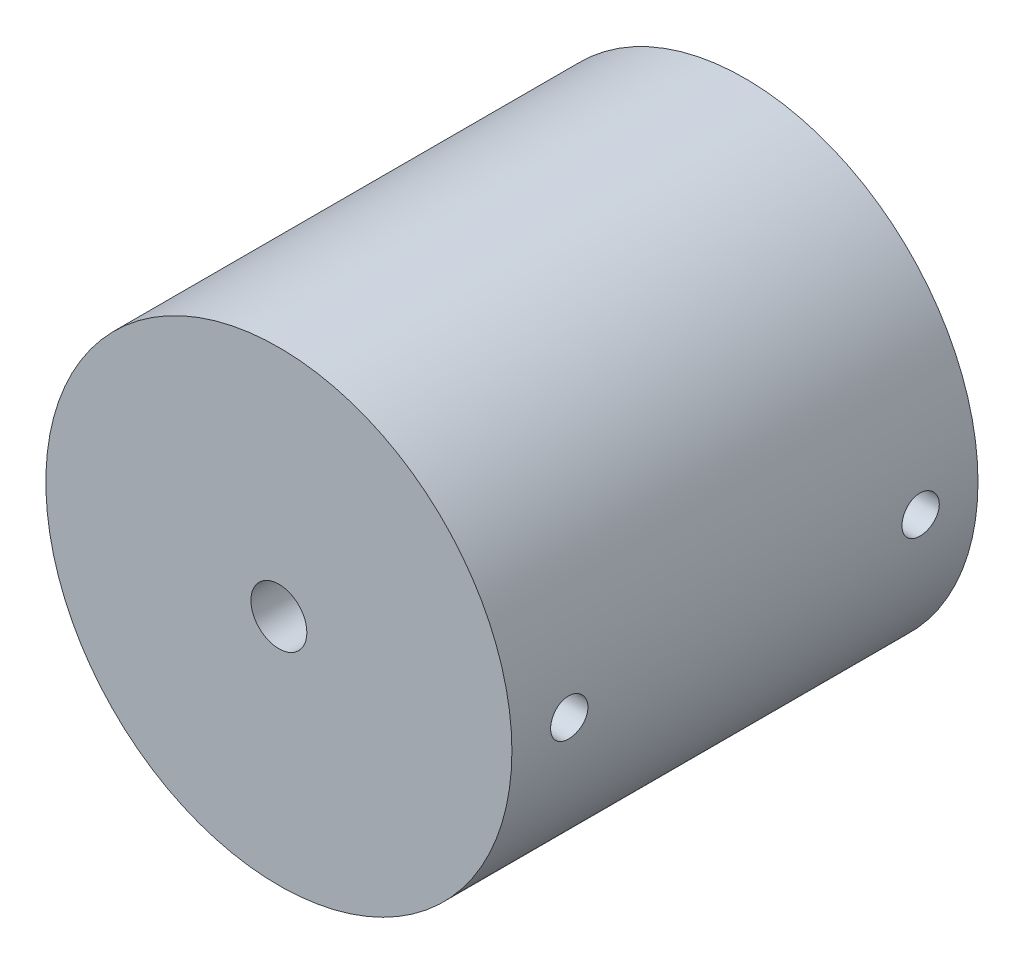
from build123d import *

# Parameters (mm, degrees)
SKETCH1_R               = 25
BOSS_EXTRUDE1_DEPTH     = 50
SKETCH2_R               = 3
CUT_EXTRUDE1_DEPTH      = 20
SKETCH3_R               = 4
CUT_EXTRUDE2_DEPTH      = 30
CUT_EXTRUDE3_DEPTH      = 62.23724357
CUT_EXTRUDE3_DEPTH_BACK = 62.23724357
SKETCH4_R               = 2


with BuildPart() as part:
    # Sketch1 → Boss-Extrude1 (new body)
    with BuildSketch(Plane.XY):
        Circle(SKETCH1_R)
    extrude(amount=BOSS_EXTRUDE1_DEPTH)

    # Sketch2 → Cut-Extrude1 (cut)
    with BuildSketch(Plane.XY.offset(50)):
        Circle(SKETCH2_R)
    extrude(amount=-CUT_EXTRUDE1_DEPTH, mode=Mode.SUBTRACT)

    # Sketch3 → Cut-Extrude2 (cut)
    with BuildSketch(Plane(origin=(0, 0, 0), x_dir=(-1, 0, 0), z_dir=(0, 0, -1))):
        Circle(SKETCH3_R)
    extrude(amount=-CUT_EXTRUDE2_DEPTH, mode=Mode.SUBTRACT)

    # Sketch4 → Cut-Extrude3 (cut, two sides: drawn at the far end of the back side and taken through both)
    with BuildSketch(Plane(origin=(0, 0, 0), x_dir=(0, 0, -1), z_dir=(1, 0, 0)).offset(-CUT_EXTRUDE3_DEPTH_BACK)):
        with Locations((-43.847378844, 0)):
            Circle(SKETCH4_R)
        with Locations((-6.152621156, 0)):
            Circle(SKETCH4_R)
    extrude(amount=CUT_EXTRUDE3_DEPTH + CUT_EXTRUDE3_DEPTH_BACK, mode=Mode.SUBTRACT)


solid = part.part
